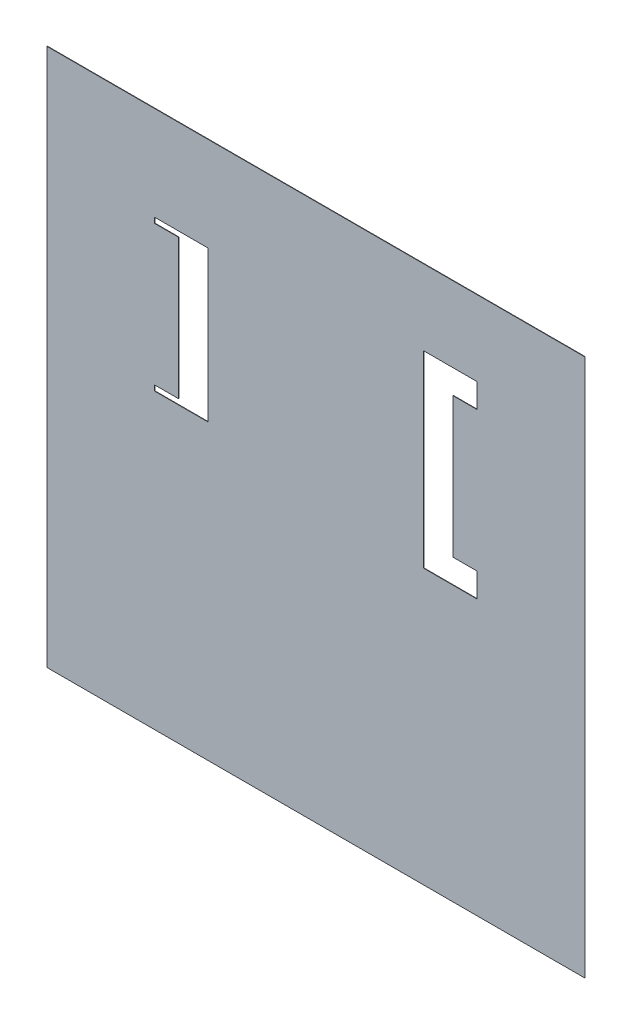
from build123d import *

# Parameters (mm, degrees)
SKETCH1_W               = 25.4
SKETCH1_H               = 25.4
BOSS_EXTRUDE1_DEPTH     = 0.02032
CUT_EXTRUDE8_DEPTH      = 3.556
CUT_EXTRUDE8_DEPTH_BACK = 36.921030232


with BuildPart() as part:
    # Sketch1 → Boss-Extrude1 (new body)
    with BuildSketch(Plane.XY):
        with Locations((12.7, 12.7)):
            Rectangle(SKETCH1_W, SKETCH1_H)
    extrude(amount=BOSS_EXTRUDE1_DEPTH)

    # Sketch2 → Cut-Extrude8 (cut, two sides: drawn at the far end of the back side and taken through both)
    with BuildSketch(Plane.XY.offset(0.02032).offset(-CUT_EXTRUDE8_DEPTH_BACK)):
        Polygon((5.08, 20.955), (7.62, 20.955), (7.62, 13.843), (5.08, 13.843), (5.08, 14.097), (6.223, 14.097), (6.223, 20.701), (5.08, 20.701), align=None)
        Polygon((17.78, 21.844), (20.32, 21.844), (20.32, 20.701), (19.177, 20.701), (19.177, 14.097), (20.32, 14.097), (20.32, 12.954), (17.78, 12.954), align=None)
    extrude(amount=CUT_EXTRUDE8_DEPTH + CUT_EXTRUDE8_DEPTH_BACK, mode=Mode.SUBTRACT)


solid = part.part
